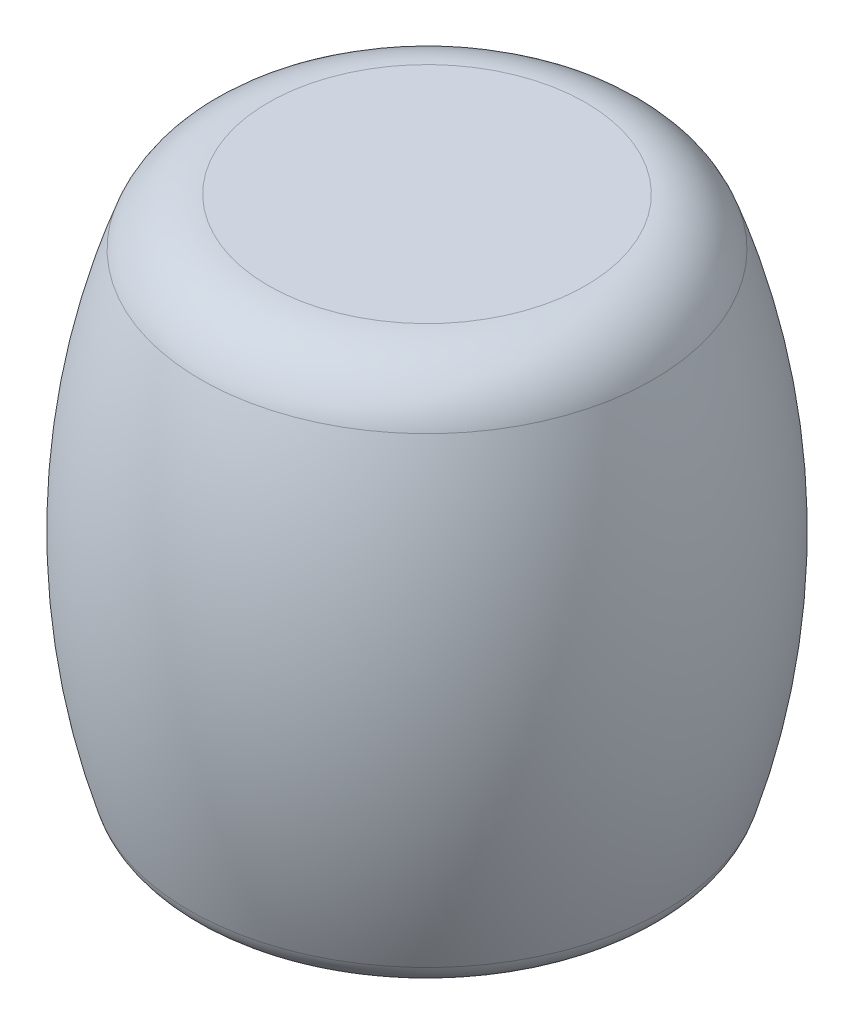
from build123d import *

# Parameters (mm, degrees)
SKETCH3_R          = 81
SKETCH3_R_2        = 77.501248024
CUT_EXTRUDE1_DEPTH = 20


with BuildPart() as part:
    # Sketch2 → Revolve1 (revolve)
    with BuildSketch(Plane.XY, mode=Mode.PRIVATE) as revolve1_sk:
        with BuildLine():
            ThreePointArc((4.414536229, 200.169084884), (-6.562247931, 214.546614293), (-23.8093847, 220))
            Line((-23.8093847, 220), (-90, 220))
            Line((-90, 220), (-90, 205))
            Line((-90, 205), (-23.8093847, 205))
            ThreePointArc((-23.8093847, 205), (-15.185816315, 202.273307147), (-9.697424235, 195.084542442))
            ThreePointArc((-9.697424235, 195.084542442), (7.092454929, 105.350657564), (-5.351514207, 14.911629651))
            Line((-5.351514207, 14.911629651), (-12.498751976, 14.23707021))
            Line((-12.498751976, 14.23707021), (-12.498751976, 0))
            Line((-12.498751976, 0), (-3.725690982, 0))
            ThreePointArc((-3.725690982, 0), (4.207002118, 3.351579232), (8.989178365, 10.513387209))
            ThreePointArc((8.989178365, 10.513387209), (22.088093244, 105.71236396), (4.414536229, 200.169084884))
        make_face()
    revolve(revolve1_sk.sketch.rotate(Axis((-90, -83.445440151, 0), (0, 1, 0)), 90), axis=Axis((-90, -83.445440151, 0), (0, 1, 0)))

    # Sketch3 → Cut-Extrude1 (cut)
    with BuildSketch(Plane.XZ):
        with Locations(Location((-90, 0, 0), (0, 0, 270))):
            Circle(SKETCH3_R)
        with Locations((-90, 0)):
            Circle(SKETCH3_R_2, mode=Mode.SUBTRACT)
    extrude(amount=-CUT_EXTRUDE1_DEPTH, mode=Mode.SUBTRACT)


solid = part.part
